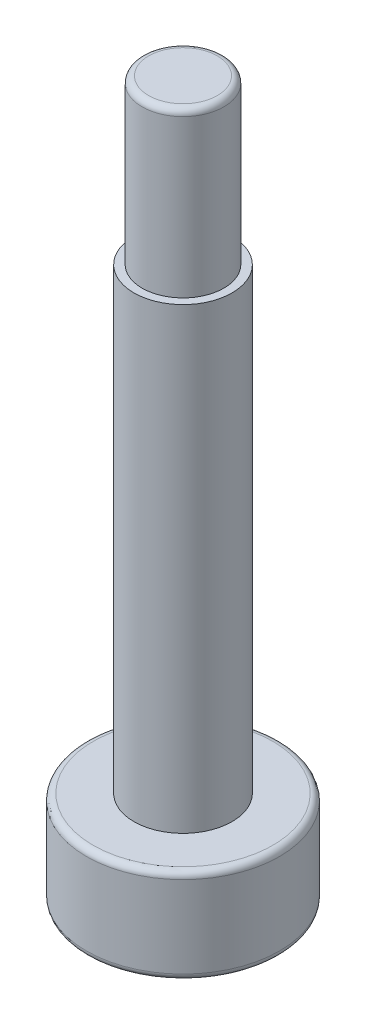
from build123d import *

# Parameters (mm, degrees)
SKETCH_1_R          = 2.95
EXTRUDE_1_DEPTH     = 2.9
SKETCH_2_R          = 1.5
EXTRUDE_2_DEPTH     = 14
SKETCH_3_R          = 1.25
EXTRUDE_3_DEPTH     = 5
CUT_EXTRUDE_1_DEPTH = 2
FILLET_1_R          = 0.2


with BuildPart() as part:
    # 草图1 → 凸台-拉伸1 (new body)
    with BuildSketch(Plane(origin=(0, 0, 0), x_dir=(1, 0, 0), z_dir=(0, 1, 0))):
        with Locations(Location((0, 0, 0), (0, 0, 270))):
            Circle(SKETCH_1_R)
    extrude(amount=EXTRUDE_1_DEPTH)

    # 草图2 → 凸台-拉伸2 (add)
    with BuildSketch(Plane(origin=(0, 2.9, 0), x_dir=(1, 0, 0), z_dir=(0, 1, 0))):
        with Locations(Location((0, 0, 0), (0, 0, 270))):
            Circle(SKETCH_2_R)
    extrude(amount=EXTRUDE_2_DEPTH)

    # 草图3 → 凸台-拉伸3 (add)
    with BuildSketch(Plane(origin=(0, 16.9, 0), x_dir=(1, 0, 0), z_dir=(0, 1, 0))):
        with Locations(Location((0, 0, 0), (0, 0, 270))):
            Circle(SKETCH_3_R)
    extrude(amount=EXTRUDE_3_DEPTH)

    # 草图4 → 切除-拉伸1 (cut)
    with BuildSketch(Plane.XZ):
        Polygon((2.247285488, -0.53201623), (1.584382314, 1.680198207), (-0.662903174, 2.212214437), (-2.247285488, 0.53201623), (-1.584382314, -1.680198207), (0.662903174, -2.212214437), align=None)
    extrude(amount=-CUT_EXTRUDE_1_DEPTH, mode=Mode.SUBTRACT)

    # 圆角1
    fillet_1_edges = [part.edges().sort_by_distance(p)[0] for p in [
        (0, 21.9, -1.25),
        (0, 0, -2.95),
        (0, 2.9, -2.95),
    ]]
    fillet(fillet_1_edges, radius=FILLET_1_R)


solid = part.part
